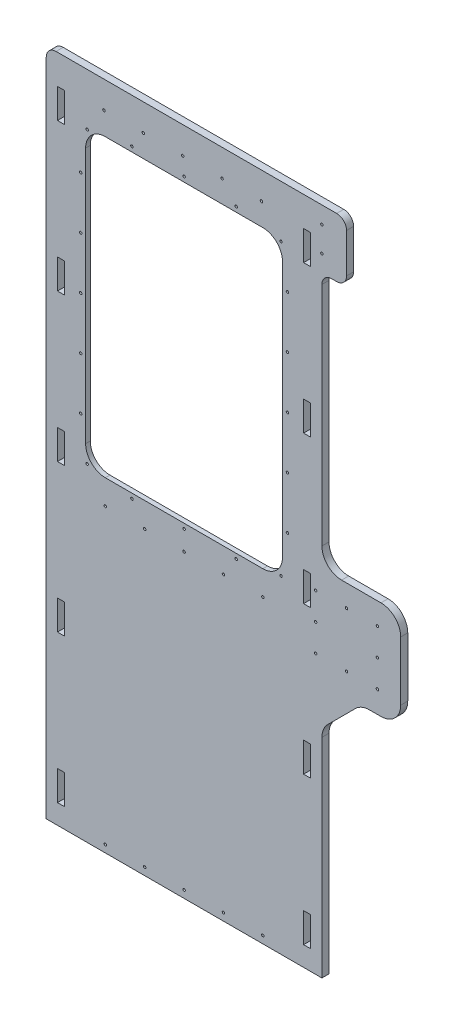
from build123d import *

# Parameters (mm, degrees)
BOSS_EXTRUDE1_DEPTH      = 18.288
SKETCH1_W                = 18.288
SKETCH1_H                = 76.2
MORTISE_CUTS_DEPTH       = 1955.524073472
LPATTERN1_COUNT          = 5
LPATTERN1_PITCH          = 381
WINDOW_RECESS_DEPTH      = 6.35
SKETCH3_R                = 3.175
CUT_EXTRUDE4_DEPTH       = 1955.474972641
SKETCH6_R                = 3.175
CUT_EXTRUDE5_DEPTH       = 1955.474972641
LPATTERN2_COUNT          = 3
LPATTERN2_PITCH          = 134.62
LPATTERN2_COL_COUNT      = 3
LPATTERN2_COL_PITCH      = 134.62
MIRROR1_COPY_1_SKETCH_R  = 3.175
MIRROR1_COPY_1_DEPTH     = 1955.474972641
MIRROR1_COPY_2_SKETCH_R  = 3.175
MIRROR1_COPY_2_DEPTH     = 1955.474972641
MIRROR1_COPY_3_SKETCH_R  = 3.175
MIRROR1_COPY_3_DEPTH     = 1955.474972641
MIRROR1_COPY_4_SKETCH_R  = 3.175
MIRROR1_COPY_4_DEPTH     = 1955.474972641
SKETCH7_R                = 3.175
CUT_EXTRUDE6_DEPTH       = 1955.474972641
LPATTERN3_COUNT          = 2
LPATTERN3_PITCH          = 134.62
LPATTERN3_COL_COUNT      = 2
LPATTERN3_COL_PITCH      = 134.62
MIRROR2_COPY_1_SKETCH_R  = 3.175
MIRROR2_COPY_1_DEPTH     = 1955.474972641
MIRROR2_COPY_2_SKETCH_R  = 3.175
MIRROR2_COPY_2_DEPTH     = 1955.474972641
MIRROR4_COPY_1_SKETCH_W  = 18.288
MIRROR4_COPY_1_SKETCH_H  = 76.2
MIRROR4_COPY_1_DEPTH     = 1955.524073472
MIRROR4_COPY_2_SKETCH_W  = 18.288
MIRROR4_COPY_2_SKETCH_H  = 76.2
MIRROR4_COPY_2_DEPTH     = 1955.524073472
MIRROR4_COPY_3_SKETCH_W  = 18.288
MIRROR4_COPY_3_SKETCH_H  = 76.2
MIRROR4_COPY_3_DEPTH     = 1955.524073472
MIRROR4_COPY_4_SKETCH_W  = 18.288
MIRROR4_COPY_4_SKETCH_H  = 76.2
MIRROR4_COPY_4_DEPTH     = 1955.524073472
MIRROR4_COPY_5_SKETCH_R  = 3.175
MIRROR4_COPY_5_DEPTH     = 1955.474972641
MIRROR4_COPY_6_SKETCH_R  = 3.175
MIRROR4_COPY_6_DEPTH     = 1955.474972641
MIRROR4_COPY_7_SKETCH_R  = 3.175
MIRROR4_COPY_7_DEPTH     = 1955.474972641
MIRROR4_COPY_8_SKETCH_R  = 3.175
MIRROR4_COPY_8_DEPTH     = 1955.474972641
MIRROR4_COPY_9_SKETCH_R  = 3.175
MIRROR4_COPY_9_DEPTH     = 1955.474972641
MIRROR4_COPY_10_SKETCH_R = 3.175
MIRROR4_COPY_10_DEPTH    = 1955.474972641
MIRROR4_COPY_11_SKETCH_R = 3.175
MIRROR4_COPY_11_DEPTH    = 1955.474972641
MIRROR4_COPY_12_SKETCH_R = 3.175
MIRROR4_COPY_12_DEPTH    = 1955.474972641
MIRROR4_COPY_13_SKETCH_R = 3.175
MIRROR4_COPY_13_DEPTH    = 1955.474972641
MIRROR4_COPY_14_SKETCH_R = 3.175
MIRROR4_COPY_14_DEPTH    = 1955.474972641
MIRROR4_COPY_15_SKETCH_R = 3.175
MIRROR4_COPY_15_DEPTH    = 1955.474972641
MIRROR4_COPY_16_SKETCH_R = 3.175
MIRROR4_COPY_16_DEPTH    = 1955.474972641
MIRROR4_COPY_17_SKETCH_R = 3.175
MIRROR4_COPY_17_DEPTH    = 1955.474972641
MIRROR4_COPY_18_SKETCH_R = 3.175
MIRROR4_COPY_18_DEPTH    = 1955.474972641
SKETCH11_R               = 3.175
CUT_EXTRUDE7_DEPTH       = 1955.524073472
SKETCH12_R               = 3.175
CUT_EXTRUDE8_DEPTH       = 1955.524073472
SKETCH13_R               = 3.175
CUT_EXTRUDE9_DEPTH       = 1955.524073472
SKETCH14_R               = 3.175
CUT_EXTRUDE10_DEPTH      = 1955.524073472


with BuildPart() as part:
    # Model → Boss-Extrude1 (new body)
    with BuildSketch(Plane.XY):
        with BuildLine():
            Line((797.921024484, 645.521024484), (726.078975516, 573.678975516))
            ThreePointArc((726.078975516, 573.678975516), (715.066919748, 557.198269396), (711.2, 537.757951031))
            Line((711.2, 537.757951031), (711.2, 0))
            Line((711.2, 0), (0, 0))
            Line((0, 0), (0, 1701.93973))
            ThreePointArc((0, 1701.93973), (7.439487758, 1719.900242242), (25.4, 1727.33973))
            Line((25.4, 1727.33973), (711.2, 1727.33973))
            Line((711.2, 1727.33973), (749.3, 1727.33973))
            ThreePointArc((749.3, 1727.33973), (767.260512242, 1719.900242242), (774.7, 1701.93973))
            Line((774.7, 1701.93973), (774.7, 1600.33973))
            ThreePointArc((774.7, 1600.33973), (767.260512242, 1582.379217758), (749.3, 1574.93973))
            Line((749.3, 1574.93973), (736.6, 1574.93973))
            ThreePointArc((736.6, 1574.93973), (718.639487758, 1567.500242242), (711.2, 1549.53973))
            Line((711.2, 1549.53973), (711.2, 965.2))
            ThreePointArc((711.2, 965.2), (726.078975516, 929.278975516), (762, 914.4))
            Line((762, 914.4), (863.6, 914.4))
            ThreePointArc((863.6, 914.4), (899.521024484, 899.521024484), (914.4, 863.6))
            Line((914.4, 863.6), (914.4, 711.2))
            ThreePointArc((914.4, 711.2), (899.521024484, 675.278975516), (863.6, 660.4))
            Line((863.6, 660.4), (833.842048969, 660.4))
            ThreePointArc((833.842048969, 660.4), (814.401730604, 656.533080252), (797.921024484, 645.521024484))
        make_face()
        with BuildLine():
            Line((558.8, 838.33973), (152.4, 838.33973))
            ThreePointArc((152.4, 838.33973), (116.478975516, 853.218705516), (101.6, 889.13973))
            Line((101.6, 889.13973), (101.6, 1549.53973))
            ThreePointArc((101.6, 1549.53973), (116.478975516, 1585.460754484), (152.4, 1600.33973))
            Line((152.4, 1600.33973), (558.8, 1600.33973))
            ThreePointArc((558.8, 1600.33973), (594.721024484, 1585.460754484), (609.6, 1549.53973))
            Line((609.6, 1549.53973), (609.6, 889.13973))
            ThreePointArc((609.6, 889.13973), (594.721024484, 853.218705516), (558.8, 838.33973))
        make_face(mode=Mode.SUBTRACT)
    boss_extrude1 = extrude(amount=BOSS_EXTRUDE1_DEPTH)

    # Sketch1 → Mortise cuts (cut, through all)
    with BuildSketch(Plane.XY.offset(18.288)):
        with Locations((673.1, 88.9)):
            Rectangle(SKETCH1_W, SKETCH1_H)
        with Locations((38.1, 88.9)):
            Rectangle(SKETCH1_W, SKETCH1_H)
    mortise_cuts = extrude(amount=-MORTISE_CUTS_DEPTH, mode=Mode.SUBTRACT)

    # LPattern1: Mortise cuts ×5
    with Locations(*[(0, i * LPATTERN1_PITCH, 0) for i in range(1, LPATTERN1_COUNT)]):
        add(mortise_cuts, mode=Mode.SUBTRACT)

    # Sketch2 → Window Recess (cut)
    with BuildSketch(Plane.XY.offset(18.288)):
        with BuildLine():
            Line((635, 889.13973), (635, 1549.53973))
            ThreePointArc((635, 1549.53973), (612.681536726, 1603.421266726), (558.8, 1625.73973))
            Line((558.8, 1625.73973), (152.4, 1625.73973))
            ThreePointArc((152.4, 1625.73973), (98.518463274, 1603.421266726), (76.2, 1549.53973))
            Line((76.2, 1549.53973), (76.2, 889.13973))
            ThreePointArc((76.2, 889.13973), (98.518463274, 835.258193274), (152.4, 812.93973))
            Line((152.4, 812.93973), (558.8, 812.93973))
            ThreePointArc((558.8, 812.93973), (612.681536726, 835.258193274), (635, 889.13973))
        make_face()
    window_recess = extrude(amount=-WINDOW_RECESS_DEPTH, mode=Mode.SUBTRACT)

    # Sketch3 → Cut-Extrude4 (cut, through all)
    with BuildSketch(Plane.XY.offset(11.938)):
        with Locations((105.582684355, 1592.867273145)):
            Circle(SKETCH3_R)
        with Locations((605.617315645, 1592.867273145)):
            Circle(SKETCH3_R)
        with Locations((605.617315645, 845.812186855)):
            Circle(SKETCH3_R)
        with Locations((105.582684355, 845.812186855)):
            Circle(SKETCH3_R)
    cut_extrude4 = extrude(amount=-CUT_EXTRUDE4_DEPTH, mode=Mode.SUBTRACT)

    # Sketch6 → Cut-Extrude5 (cut, through all)
    with BuildSketch(Plane.XY.offset(11.938)):
        with Locations((88.9, 1219.33973)):
            Circle(SKETCH6_R)
    cut_extrude5 = extrude(amount=-CUT_EXTRUDE5_DEPTH, mode=Mode.SUBTRACT)

    # LPattern2: Cut-Extrude5 ×3
    with Locations(*[(0, -i * LPATTERN2_PITCH, 0) for i in range(1, LPATTERN2_COUNT)]):
        add(cut_extrude5, mode=Mode.SUBTRACT)

    # LPattern2 col: Cut-Extrude5 ×3
    with Locations(*[(0, i * LPATTERN2_COL_PITCH, 0) for i in range(1, LPATTERN2_COL_COUNT)]):
        add(cut_extrude5, mode=Mode.SUBTRACT)

    # Mirror1: Cut-Extrude5 across plane
    add(cut_extrude5.mirror(Plane.ZY.offset(-355.6)), mode=Mode.SUBTRACT)

    # Mirror1 copy 1 sketch → Mirror1 copy 1 (cut, through all)
    with BuildSketch(Plane(origin=(711.2, -134.62, 11.938), x_dir=(-1, 0, 0), z_dir=(0, 0, 1))):
        with Locations((88.9, -1219.33973)):
            Circle(MIRROR1_COPY_1_SKETCH_R)
    extrude(amount=-MIRROR1_COPY_1_DEPTH, mode=Mode.SUBTRACT)

    # Mirror1 copy 2 sketch → Mirror1 copy 2 (cut, through all)
    with BuildSketch(Plane(origin=(711.2, -269.24, 11.938), x_dir=(-1, 0, 0), z_dir=(0, 0, 1))):
        with Locations((88.9, -1219.33973)):
            Circle(MIRROR1_COPY_2_SKETCH_R)
    extrude(amount=-MIRROR1_COPY_2_DEPTH, mode=Mode.SUBTRACT)

    # Mirror1 copy 3 sketch → Mirror1 copy 3 (cut, through all)
    with BuildSketch(Plane(origin=(711.2, 134.62, 11.938), x_dir=(-1, 0, 0), z_dir=(0, 0, 1))):
        with Locations((88.9, -1219.33973)):
            Circle(MIRROR1_COPY_3_SKETCH_R)
    extrude(amount=-MIRROR1_COPY_3_DEPTH, mode=Mode.SUBTRACT)

    # Mirror1 copy 4 sketch → Mirror1 copy 4 (cut, through all)
    with BuildSketch(Plane(origin=(711.2, 269.24, 11.938), x_dir=(-1, 0, 0), z_dir=(0, 0, 1))):
        with Locations((88.9, -1219.33973)):
            Circle(MIRROR1_COPY_4_SKETCH_R)
    extrude(amount=-MIRROR1_COPY_4_DEPTH, mode=Mode.SUBTRACT)

    # Sketch7 → Cut-Extrude6 (cut, through all)
    with BuildSketch(Plane.XY.offset(11.938)):
        with Locations((355.6, 1613.03973)):
            Circle(SKETCH7_R)
    cut_extrude6 = extrude(amount=-CUT_EXTRUDE6_DEPTH, mode=Mode.SUBTRACT)

    # LPattern3: Cut-Extrude6 ×2
    with Locations(*[(i * LPATTERN3_PITCH, 0, 0) for i in range(1, LPATTERN3_COUNT)]):
        add(cut_extrude6, mode=Mode.SUBTRACT)

    # LPattern3 col: Cut-Extrude6 ×2
    with Locations(*[(-i * LPATTERN3_COL_PITCH, 0, 0) for i in range(1, LPATTERN3_COL_COUNT)]):
        add(cut_extrude6, mode=Mode.SUBTRACT)

    # Mirror2: Cut-Extrude6 across plane
    add(cut_extrude6.mirror(Plane(origin=(0, 1219.33973, 0), x_dir=(0, 0, 1), z_dir=(0, -1, 0))), mode=Mode.SUBTRACT)

    # Mirror2 copy 1 sketch → Mirror2 copy 1 (cut, through all)
    with BuildSketch(Plane(origin=(134.62, 2438.67946, 11.938), x_dir=(1, 0, 0), z_dir=(0, 0, 1))):
        with Locations((355.6, -1613.03973)):
            Circle(MIRROR2_COPY_1_SKETCH_R)
    extrude(amount=-MIRROR2_COPY_1_DEPTH, mode=Mode.SUBTRACT)

    # Mirror2 copy 2 sketch → Mirror2 copy 2 (cut, through all)
    with BuildSketch(Plane(origin=(-134.62, 2438.67946, 11.938), x_dir=(1, 0, 0), z_dir=(0, 0, 1))):
        with Locations((355.6, -1613.03973)):
            Circle(MIRROR2_COPY_2_SKETCH_R)
    extrude(amount=-MIRROR2_COPY_2_DEPTH, mode=Mode.SUBTRACT)

    # Mirror4: Boss-Extrude1, Mortise cuts, Window Recess, Cut-Extrude4, Cut-Extrude5, Cut-Extrude6 across plane
    add(boss_extrude1.mirror(Plane(origin=(0, 0, 9.144), x_dir=(1, 0, 0), z_dir=(0, 0, -1))))
    add(mortise_cuts.mirror(Plane(origin=(0, 0, 9.144), x_dir=(1, 0, 0), z_dir=(0, 0, -1))), mode=Mode.SUBTRACT)
    add(window_recess.mirror(Plane(origin=(0, 0, 9.144), x_dir=(1, 0, 0), z_dir=(0, 0, -1))), mode=Mode.SUBTRACT)
    add(cut_extrude4.mirror(Plane(origin=(0, 0, 9.144), x_dir=(1, 0, 0), z_dir=(0, 0, -1))), mode=Mode.SUBTRACT)
    add(cut_extrude5.mirror(Plane(origin=(0, 0, 9.144), x_dir=(1, 0, 0), z_dir=(0, 0, -1))), mode=Mode.SUBTRACT)
    add(cut_extrude6.mirror(Plane(origin=(0, 0, 9.144), x_dir=(1, 0, 0), z_dir=(0, 0, -1))), mode=Mode.SUBTRACT)

    # Mirror4 copy 1 sketch → Mirror4 copy 1 (cut, through all)
    with BuildSketch(Plane(origin=(0, 381, 0), x_dir=(1, 0, 0), z_dir=(0, 0, -1))):
        with Locations((673.1, -88.9)):
            Rectangle(MIRROR4_COPY_1_SKETCH_W, MIRROR4_COPY_1_SKETCH_H)
        with Locations((38.1, -88.9)):
            Rectangle(MIRROR4_COPY_1_SKETCH_W, MIRROR4_COPY_1_SKETCH_H)
    extrude(amount=-MIRROR4_COPY_1_DEPTH, mode=Mode.SUBTRACT)

    # Mirror4 copy 2 sketch → Mirror4 copy 2 (cut, through all)
    with BuildSketch(Plane(origin=(0, 762, 0), x_dir=(1, 0, 0), z_dir=(0, 0, -1))):
        with Locations((673.1, -88.9)):
            Rectangle(MIRROR4_COPY_2_SKETCH_W, MIRROR4_COPY_2_SKETCH_H)
        with Locations((38.1, -88.9)):
            Rectangle(MIRROR4_COPY_2_SKETCH_W, MIRROR4_COPY_2_SKETCH_H)
    extrude(amount=-MIRROR4_COPY_2_DEPTH, mode=Mode.SUBTRACT)

    # Mirror4 copy 3 sketch → Mirror4 copy 3 (cut, through all)
    with BuildSketch(Plane(origin=(0, 1143, 0), x_dir=(1, 0, 0), z_dir=(0, 0, -1))):
        with Locations((673.1, -88.9)):
            Rectangle(MIRROR4_COPY_3_SKETCH_W, MIRROR4_COPY_3_SKETCH_H)
        with Locations((38.1, -88.9)):
            Rectangle(MIRROR4_COPY_3_SKETCH_W, MIRROR4_COPY_3_SKETCH_H)
    extrude(amount=-MIRROR4_COPY_3_DEPTH, mode=Mode.SUBTRACT)

    # Mirror4 copy 4 sketch → Mirror4 copy 4 (cut, through all)
    with BuildSketch(Plane(origin=(0, 1524, 0), x_dir=(1, 0, 0), z_dir=(0, 0, -1))):
        with Locations((673.1, -88.9)):
            Rectangle(MIRROR4_COPY_4_SKETCH_W, MIRROR4_COPY_4_SKETCH_H)
        with Locations((38.1, -88.9)):
            Rectangle(MIRROR4_COPY_4_SKETCH_W, MIRROR4_COPY_4_SKETCH_H)
    extrude(amount=-MIRROR4_COPY_4_DEPTH, mode=Mode.SUBTRACT)

    # Mirror4 copy 5 sketch → Mirror4 copy 5 (cut, through all)
    with BuildSketch(Plane(origin=(0, -134.62, 6.35), x_dir=(1, 0, 0), z_dir=(0, 0, -1))):
        with Locations((88.9, -1219.33973)):
            Circle(MIRROR4_COPY_5_SKETCH_R)
    extrude(amount=-MIRROR4_COPY_5_DEPTH, mode=Mode.SUBTRACT)

    # Mirror4 copy 6 sketch → Mirror4 copy 6 (cut, through all)
    with BuildSketch(Plane(origin=(0, -269.24, 6.35), x_dir=(1, 0, 0), z_dir=(0, 0, -1))):
        with Locations((88.9, -1219.33973)):
            Circle(MIRROR4_COPY_6_SKETCH_R)
    extrude(amount=-MIRROR4_COPY_6_DEPTH, mode=Mode.SUBTRACT)

    # Mirror4 copy 7 sketch → Mirror4 copy 7 (cut, through all)
    with BuildSketch(Plane(origin=(0, 134.62, 6.35), x_dir=(1, 0, 0), z_dir=(0, 0, -1))):
        with Locations((88.9, -1219.33973)):
            Circle(MIRROR4_COPY_7_SKETCH_R)
    extrude(amount=-MIRROR4_COPY_7_DEPTH, mode=Mode.SUBTRACT)

    # Mirror4 copy 8 sketch → Mirror4 copy 8 (cut, through all)
    with BuildSketch(Plane(origin=(0, 269.24, 6.35), x_dir=(1, 0, 0), z_dir=(0, 0, -1))):
        with Locations((88.9, -1219.33973)):
            Circle(MIRROR4_COPY_8_SKETCH_R)
    extrude(amount=-MIRROR4_COPY_8_DEPTH, mode=Mode.SUBTRACT)

    # Mirror4 copy 9 sketch → Mirror4 copy 9 (cut, through all)
    with BuildSketch(Plane(origin=(711.2, 0, 6.35), x_dir=(-1, 0, 0), z_dir=(0, 0, -1))):
        with Locations((88.9, 1219.33973)):
            Circle(MIRROR4_COPY_9_SKETCH_R)
    extrude(amount=-MIRROR4_COPY_9_DEPTH, mode=Mode.SUBTRACT)

    # Mirror4 copy 10 sketch → Mirror4 copy 10 (cut, through all)
    with BuildSketch(Plane(origin=(711.2, -134.62, 6.35), x_dir=(-1, 0, 0), z_dir=(0, 0, -1))):
        with Locations((88.9, 1219.33973)):
            Circle(MIRROR4_COPY_10_SKETCH_R)
    extrude(amount=-MIRROR4_COPY_10_DEPTH, mode=Mode.SUBTRACT)

    # Mirror4 copy 11 sketch → Mirror4 copy 11 (cut, through all)
    with BuildSketch(Plane(origin=(711.2, -269.24, 6.35), x_dir=(-1, 0, 0), z_dir=(0, 0, -1))):
        with Locations((88.9, 1219.33973)):
            Circle(MIRROR4_COPY_11_SKETCH_R)
    extrude(amount=-MIRROR4_COPY_11_DEPTH, mode=Mode.SUBTRACT)

    # Mirror4 copy 12 sketch → Mirror4 copy 12 (cut, through all)
    with BuildSketch(Plane(origin=(711.2, 134.62, 6.35), x_dir=(-1, 0, 0), z_dir=(0, 0, -1))):
        with Locations((88.9, 1219.33973)):
            Circle(MIRROR4_COPY_12_SKETCH_R)
    extrude(amount=-MIRROR4_COPY_12_DEPTH, mode=Mode.SUBTRACT)

    # Mirror4 copy 13 sketch → Mirror4 copy 13 (cut, through all)
    with BuildSketch(Plane(origin=(711.2, 269.24, 6.35), x_dir=(-1, 0, 0), z_dir=(0, 0, -1))):
        with Locations((88.9, 1219.33973)):
            Circle(MIRROR4_COPY_13_SKETCH_R)
    extrude(amount=-MIRROR4_COPY_13_DEPTH, mode=Mode.SUBTRACT)

    # Mirror4 copy 14 sketch → Mirror4 copy 14 (cut, through all)
    with BuildSketch(Plane(origin=(134.62, 0, 6.35), x_dir=(1, 0, 0), z_dir=(0, 0, -1))):
        with Locations((355.6, -1613.03973)):
            Circle(MIRROR4_COPY_14_SKETCH_R)
    extrude(amount=-MIRROR4_COPY_14_DEPTH, mode=Mode.SUBTRACT)

    # Mirror4 copy 15 sketch → Mirror4 copy 15 (cut, through all)
    with BuildSketch(Plane(origin=(-134.62, 0, 6.35), x_dir=(1, 0, 0), z_dir=(0, 0, -1))):
        with Locations((355.6, -1613.03973)):
            Circle(MIRROR4_COPY_15_SKETCH_R)
    extrude(amount=-MIRROR4_COPY_15_DEPTH, mode=Mode.SUBTRACT)

    # Mirror4 copy 16 sketch → Mirror4 copy 16 (cut, through all)
    with BuildSketch(Plane(origin=(0, 2438.67946, 6.35), x_dir=(1, 0, 0), z_dir=(0, 0, -1))):
        with Locations((355.6, 1613.03973)):
            Circle(MIRROR4_COPY_16_SKETCH_R)
    extrude(amount=-MIRROR4_COPY_16_DEPTH, mode=Mode.SUBTRACT)

    # Mirror4 copy 17 sketch → Mirror4 copy 17 (cut, through all)
    with BuildSketch(Plane(origin=(134.62, 2438.67946, 6.35), x_dir=(1, 0, 0), z_dir=(0, 0, -1))):
        with Locations((355.6, 1613.03973)):
            Circle(MIRROR4_COPY_17_SKETCH_R)
    extrude(amount=-MIRROR4_COPY_17_DEPTH, mode=Mode.SUBTRACT)

    # Mirror4 copy 18 sketch → Mirror4 copy 18 (cut, through all)
    with BuildSketch(Plane(origin=(-134.62, 2438.67946, 6.35), x_dir=(1, 0, 0), z_dir=(0, 0, -1))):
        with Locations((355.6, 1613.03973)):
            Circle(MIRROR4_COPY_18_SKETCH_R)
    extrude(amount=-MIRROR4_COPY_18_DEPTH, mode=Mode.SUBTRACT)

    # Sketch11 → Cut-Extrude7 (cut, through all)
    with BuildSketch(Plane(origin=(0, 0, 0), x_dir=(-1, 0, 0), z_dir=(0, 0, -1))):
        with Locations((-152.4, 774.7)):
            Circle(SKETCH11_R)
        with Locations((-254, 774.7)):
            Circle(SKETCH11_R)
        with Locations((-355.6, 774.7)):
            Circle(SKETCH11_R)
        with Locations((-457.2, 774.7)):
            Circle(SKETCH11_R)
        with Locations((-558.8, 774.7)):
            Circle(SKETCH11_R)
        with Locations((-152.4, 19.05)):
            Circle(SKETCH11_R)
        with Locations((-254, 19.05)):
            Circle(SKETCH11_R)
        with Locations((-355.6, 19.05)):
            Circle(SKETCH11_R)
        with Locations((-457.2, 19.05)):
            Circle(SKETCH11_R)
        with Locations((-558.8, 19.05)):
            Circle(SKETCH11_R)
    extrude(amount=-CUT_EXTRUDE7_DEPTH, mode=Mode.SUBTRACT)

    # Sketch12 → Cut-Extrude8 (cut, through all)
    with BuildSketch(Plane.XY.offset(18.288)):
        with Locations((854.456, 858.012)):
            Circle(SKETCH12_R)
        with Locations((774.7, 858.012)):
            Circle(SKETCH12_R)
        with Locations((694.944, 858.012)):
            Circle(SKETCH12_R)
        with Locations((694.944, 787.4)):
            Circle(SKETCH12_R)
        with Locations((694.944, 716.788)):
            Circle(SKETCH12_R)
        with Locations((774.7, 716.788)):
            Circle(SKETCH12_R)
        with Locations((854.456, 716.788)):
            Circle(SKETCH12_R)
        with Locations((854.456, 787.4)):
            Circle(SKETCH12_R)
    extrude(amount=-CUT_EXTRUDE8_DEPTH, mode=Mode.SUBTRACT)

    # Sketch13 → Cut-Extrude9 (cut, through all)
    with BuildSketch(Plane.XY.offset(18.288)):
        with Locations((148.844, 1657.48973)):
            Circle(SKETCH13_R)
        with Locations((250.444, 1657.48973)):
            Circle(SKETCH13_R)
        with Locations((352.044, 1657.48973)):
            Circle(SKETCH13_R)
        with Locations((453.644, 1657.48973)):
            Circle(SKETCH13_R)
        with Locations((555.244, 1657.48973)):
            Circle(SKETCH13_R)
    extrude(amount=-CUT_EXTRUDE9_DEPTH, mode=Mode.SUBTRACT)

    # Sketch14 → Cut-Extrude10 (cut, through all)
    with BuildSketch(Plane.XY.offset(18.288)):
        with Locations((711.2, 1683.548964167)):
            Circle(SKETCH14_R)
        with Locations((711.2, 1618.524964167)):
            Circle(SKETCH14_R)
    extrude(amount=-CUT_EXTRUDE10_DEPTH, mode=Mode.SUBTRACT)


solid = part.part
